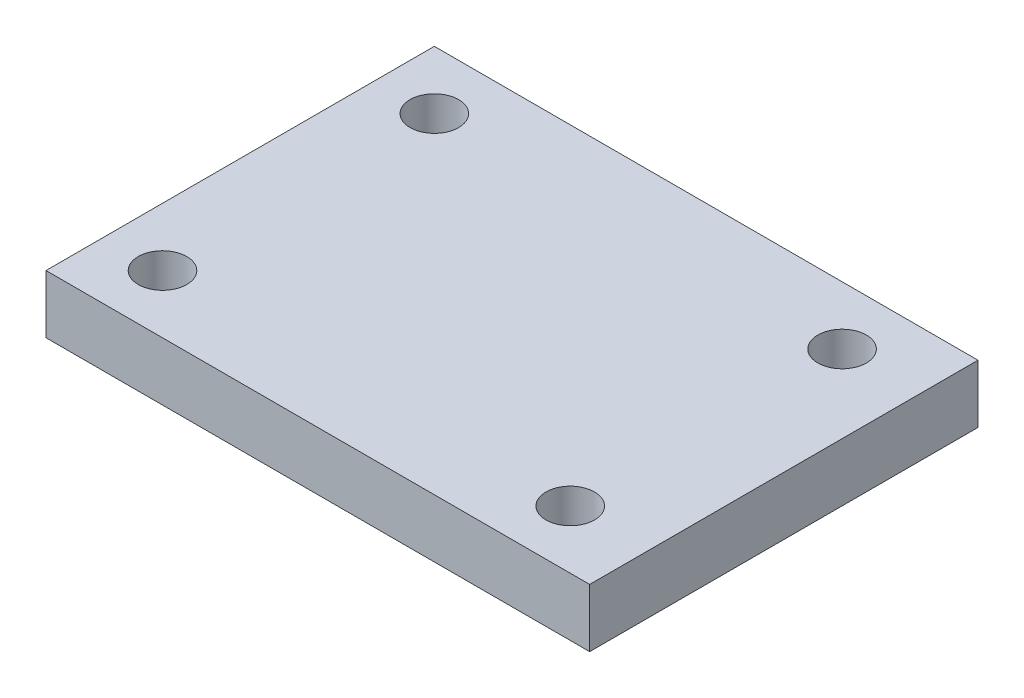
from build123d import *

# Parameters (mm, degrees)
SKETCH1_W           = 28
SKETCH1_H           = 20
BOSS_EXTRUDE1_DEPTH = 3
M3_TAPPED_HOLE1_D   = 2.5
SCALE1_SCALE        = 1.5


with BuildPart() as part:
    # Sketch1 → Boss-Extrude1 (new body)
    with BuildSketch(Plane(origin=(0, 0, 0), x_dir=(1, 0, 0), z_dir=(0, 1, 0))):
        Rectangle(SKETCH1_W, SKETCH1_H)
    extrude(amount=BOSS_EXTRUDE1_DEPTH)

    # M3 Tapped Hole1 (through all)
    with Locations(Plane(origin=(0, 3, 0), x_dir=(1, 0, 0), z_dir=(0, 1, 0))):
        with Locations((-11, 7), (-11, -7), (10, -7), (10, 7)):
            Hole(M3_TAPPED_HOLE1_D / 2)


with BuildPart() as part_1:
    # Scale1: scaled about (0.018168231, 1.5, 0)
    add(part.part.scale(SCALE1_SCALE).moved(Location((-0.009084115, -0.75, 0))))


solid = part_1.part
